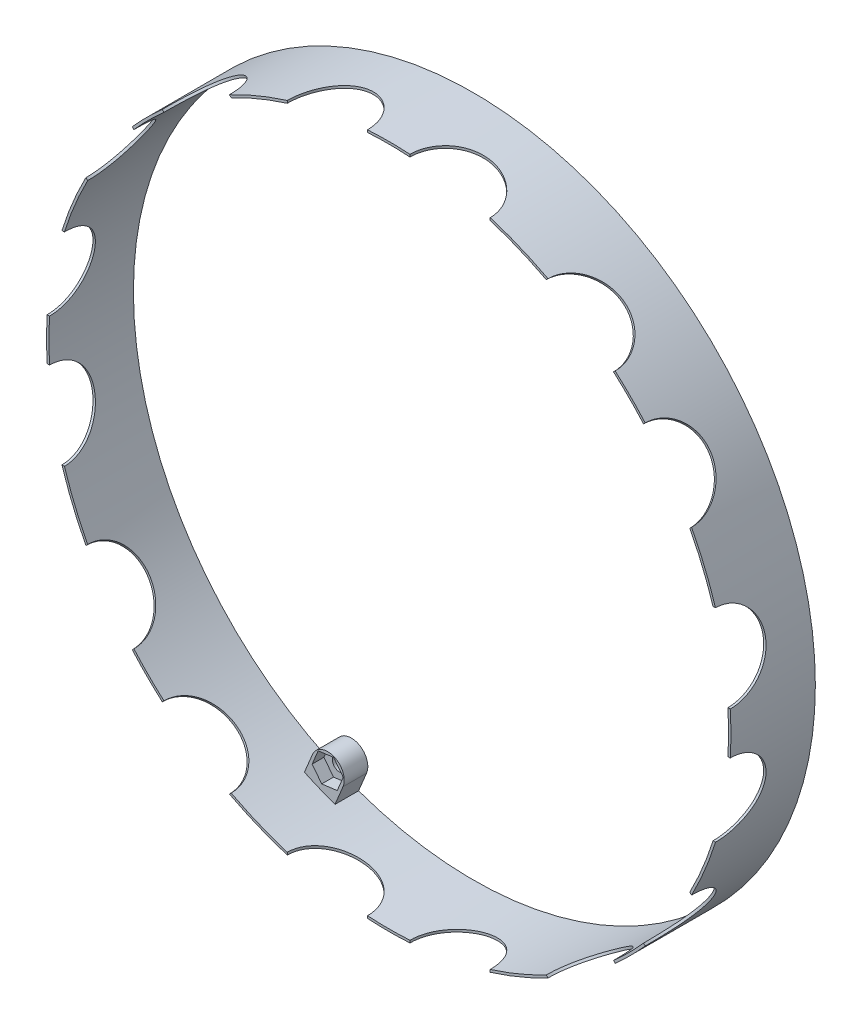
from build123d import *

# Parameters (mm, degrees)
SKIZZE4_R            = 72.5
SKIZZE4_R_2          = 72
BASE_RING_DEPTH      = 17.9
ULTRASONIC_CUT_DEPTH = 105.081266326
ROTATION_I_COUNT     = 8
SCREW_BASE_DEPTH     = 5
SKIZZE7_R            = 1.5
SCREW_CENTER_DEPTH   = 104.338811836
SKIZZE7_3_R          = 1.5
HEX_NUT_DEPTH        = 2.5
KREISMUSTER2_COUNT   = 2


with BuildPart() as part:
    # Skizze4 → Base Ring (new body)
    with BuildSketch(Plane.XY):
        Circle(SKIZZE4_R)
        Circle(SKIZZE4_R_2, mode=Mode.SUBTRACT)
    extrude(amount=BASE_RING_DEPTH)

    # Skizze5 → Ultrasonic Cut (cut, through all)
    with BuildSketch(Plane(origin=(0, 0, 0), x_dir=(0, 0, -1), z_dir=(1, 0, 0))):
        with BuildLine():
            Line((-17.9, 4.5), (-48.848327202, 4.5))
            Line((-48.848327202, 4.5), (-48.848327202, 21.5))
            Line((-48.848327202, 21.5), (-17.9, 21.5))
            ThreePointArc((-17.9, 21.5), (-9.4, 13), (-17.9, 4.5))
        make_face()
        with BuildLine():
            Line((-17.9, -21.5), (-48.848327202, -21.5))
            Line((-48.848327202, -21.5), (-48.848327202, -4.5))
            Line((-48.848327202, -4.5), (-17.9, -4.5))
            ThreePointArc((-17.9, -4.5), (-9.4, -13), (-17.9, -21.5))
        make_face()
    ultrasonic_cut = extrude(amount=ULTRASONIC_CUT_DEPTH, mode=Mode.SUBTRACT)

    # Rotation I: Ultrasonic Cut ×8 about axis
    rotation_i_axis = Axis((0, 0, 17.9), (0, 0, -1))
    for i in range(1, ROTATION_I_COUNT):
        add(ultrasonic_cut.rotate(rotation_i_axis, i * 360 / ROTATION_I_COUNT), mode=Mode.SUBTRACT)

    # Skizze6 → Screw Base (add)
    with BuildSketch(Plane.XY):
        with BuildLine():
            ThreePointArc((30.754211572, 65.101293924), (27.55320713, 66.519326341), (24.287054845, 67.78007795))
            Line((24.287054845, 67.78007795), (22.597553321, 63.701260458))
            ThreePointArc((22.597553321, 63.701260458), (24.491739671, 59.128290081), (29.064710048, 61.022476431))
            Line((29.064710048, 61.022476431), (30.754211572, 65.101293924))
        make_face()
    screw_base = extrude(amount=SCREW_BASE_DEPTH)

    # Skizze7 → Screw Center (cut, through all)
    with BuildSketch(Plane.XY.offset(5)):
        with Locations((25.831131685, 62.361868445)):
            Circle(SKIZZE7_R)
    screw_center = extrude(amount=-SCREW_CENTER_DEPTH, mode=Mode.SUBTRACT)

    # Skizze7<3> → Hex Nut (cut)
    with BuildSketch(Plane.XY.offset(5)):
        Polygon((29.122494691, 62.795184605), (27.101550385, 65.428930501), (23.810187379, 64.995614341), (22.539768678, 61.928552284), (24.560712984, 59.294806388), (27.85207599, 59.728122548), align=None)
        with Locations((25.831131685, 62.361868445)):
            Circle(SKIZZE7_3_R, mode=Mode.SUBTRACT)
    hex_nut = extrude(amount=-HEX_NUT_DEPTH, mode=Mode.SUBTRACT)

    # Kreismuster2: Screw Base, Screw Center, Hex Nut ×2 about axis
    kreismuster2_axis = Axis((0, 0, 17.9), (0, 0, -1))
    add([screw_base.rotate(kreismuster2_axis, i * 360 / KREISMUSTER2_COUNT) for i in range(1, KREISMUSTER2_COUNT)])
    add([screw_center.rotate(kreismuster2_axis, i * 360 / KREISMUSTER2_COUNT) for i in range(1, KREISMUSTER2_COUNT)], mode=Mode.SUBTRACT)
    add([hex_nut.rotate(kreismuster2_axis, i * 360 / KREISMUSTER2_COUNT) for i in range(1, KREISMUSTER2_COUNT)], mode=Mode.SUBTRACT)


solid = part.part
